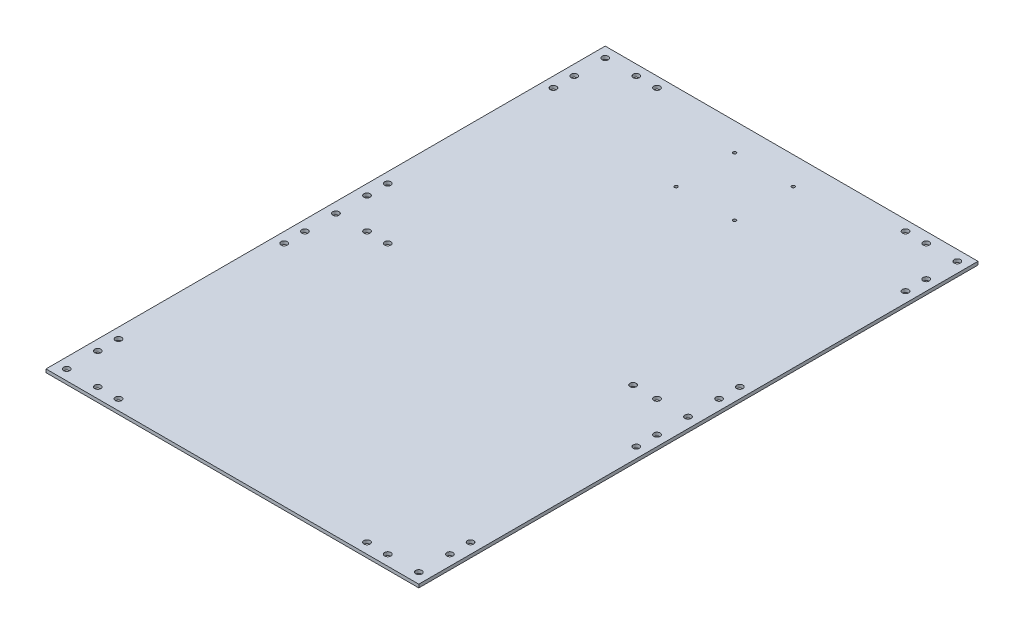
from build123d import *

# Parameters (mm, degrees)
SKETCH1_W             = 360
SKETCH1_H             = 540
BOSS_EXTRUDE1_DEPTH   = 3.175
F_3_0MM_DOWEL_HOLE1_D = 3
F_6_0MM_DOWEL_HOLE1_D = 6


with BuildPart() as part:
    # Sketch1 → Boss-Extrude1 (new body)
    with BuildSketch(Plane(origin=(0, 0, 0), x_dir=(1, 0, 0), z_dir=(0, 1, 0))):
        with Locations((180, -270)):
            Rectangle(SKETCH1_W, SKETCH1_H)
    extrude(amount=BOSS_EXTRUDE1_DEPTH)

    # Ø3.0mm Dowel Hole1 (through all)
    with Locations(Plane(origin=(0, 3.175, 0), x_dir=(1, 0, 0), z_dir=(0, 1, 0))):
        with Locations((151.715728753, -26.715728753), (208.284271247, -26.715728753), (208.284271247, -83.284271247), (151.715728753, -83.284271247)):
            Hole(F_3_0MM_DOWEL_HOLE1_D / 2)

    # Ø6.0mm Dowel Hole1 (through all)
    with Locations(Plane(origin=(0, 3.175, 0), x_dir=(1, 0, 0), z_dir=(0, 1, 0))):
        with Locations((10, -500), (40, -270), (10, -270), (10, -220), (40, -530), (10, -530), (320, -530), (350, -530), (350, -500), (10, -300), (350, -270), (10, -240), (320, -270), (350, -40), (350, -10), (320, -10), (40, -10), (10, -10), (10, -40), (60, -270), (10, -320), (10, -60), (60, -10), (300, -10), (350, -60), (350, -220), (350, -240), (296.924884631, -270), (350, -300), (350, -320), (350, -480), (300, -530), (10, -480), (60, -530)):
            Hole(F_6_0MM_DOWEL_HOLE1_D / 2)


solid = part.part
